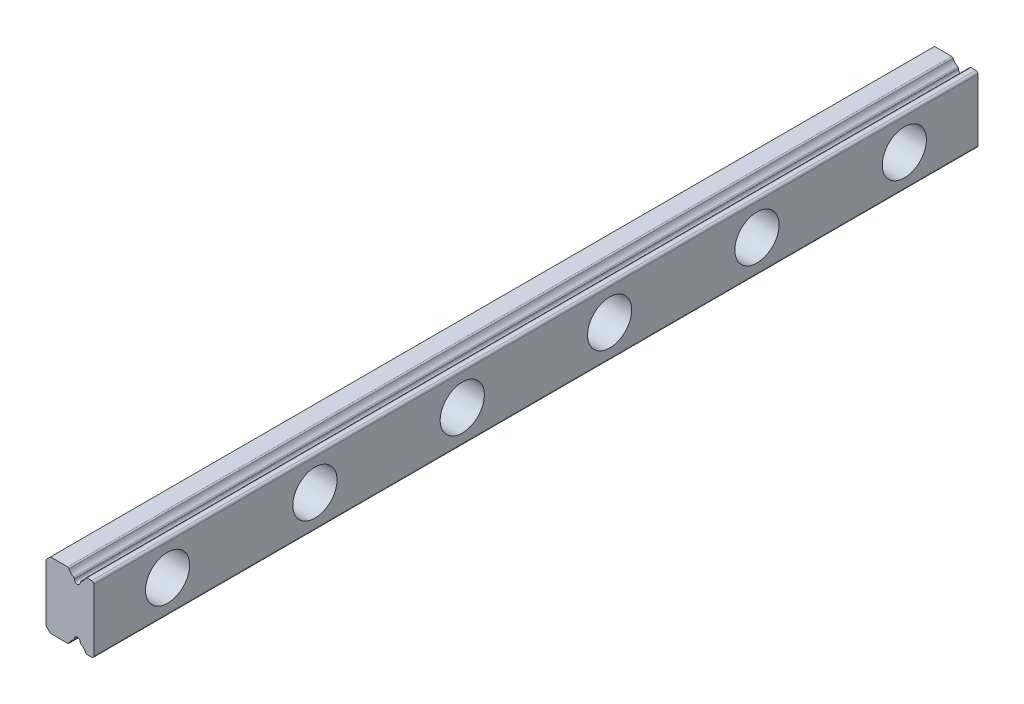
from build123d import *

# Parameters (mm, degrees)
EXTRUDE_1_DEPTH     = 120
SKETCH_2_R          = 3
CUT_EXTRUDE_1_DEPTH = 4.5
SKETCH_3_R          = 1.75
CUT_EXTRUDE_2_DEPTH = 121.421136019


with BuildPart() as part:
    # 草图1 → 凸台-拉伸1 (new body)
    with BuildSketch(Plane.XY):
        with BuildLine():
            ThreePointArc((6.2, 9), (6.412132034, 8.912132034), (6.5, 8.7))
            Line((6.5, 8.7), (6.5, 0.3))
            ThreePointArc((6.5, 0.3), (6.412132034, 0.087867966), (6.2, 0))
            Line((6.2, 0), (5.557669683, 0))
            ThreePointArc((5.557669683, 0), (5.444280341, 0.035249106), (5.370859728, 0.128571429))
            ThreePointArc((5.370859728, 0.128571429), (5.130846451, 0.514929157), (4.764285714, 0.784209483))
            ThreePointArc((4.764285714, 0.784209483), (4.680969149, 0.858006567), (4.65, 0.964911064))
            Line((4.65, 0.964911064), (4.65, 1))
            ThreePointArc((4.65, 1), (4.25, 1.4), (3.85, 1))
            Line((3.85, 1), (3.85, 0.964911064))
            ThreePointArc((3.85, 0.964911064), (3.819030851, 0.858006567), (3.735714286, 0.784209483))
            ThreePointArc((3.735714286, 0.784209483), (3.369153549, 0.514929157), (3.129140272, 0.128571429))
            ThreePointArc((3.129140272, 0.128571429), (3.055719659, 0.035249106), (2.942330317, 0))
            Line((2.942330317, 0), (0.6, 0))
            Line((0.6, 0), (0, 0.6))
            Line((0, 0.6), (0, 8.4))
            Line((0, 8.4), (0.6, 9))
            Line((0.6, 9), (2.942330317, 9))
            ThreePointArc((2.942330317, 9), (3.055719659, 8.964750894), (3.129140272, 8.871428571))
            ThreePointArc((3.129140272, 8.871428571), (3.369153549, 8.485070843), (3.735714286, 8.215790517))
            ThreePointArc((3.735714286, 8.215790517), (3.819030851, 8.141993433), (3.85, 8.035088936))
            Line((3.85, 8.035088936), (3.85, 8))
            ThreePointArc((3.85, 8), (4.25, 7.6), (4.65, 8))
            Line((4.65, 8), (4.65, 8.035088936))
            ThreePointArc((4.65, 8.035088936), (4.680969149, 8.141993433), (4.764285714, 8.215790517))
            ThreePointArc((4.764285714, 8.215790517), (5.130846451, 8.485070843), (5.370859728, 8.871428571))
            ThreePointArc((5.370859728, 8.871428571), (5.444280341, 8.964750894), (5.557669683, 9))
            Line((5.557669683, 9), (6.2, 9))
        make_face()
    extrude(amount=EXTRUDE_1_DEPTH)

    # 草图2 → 切除-拉伸1 (cut)
    with BuildSketch(Plane(origin=(6.5, 0, 0), x_dir=(0, 0, -1), z_dir=(1, 0, 0))):
        with Locations((-10, 4.5)):
            Circle(SKETCH_2_R)
        with Locations((-30, 4.5)):
            Circle(SKETCH_2_R)
        with Locations((-50, 4.5)):
            Circle(SKETCH_2_R)
        with Locations((-70, 4.5)):
            Circle(SKETCH_2_R)
        with Locations((-90, 4.5)):
            Circle(SKETCH_2_R)
        with Locations((-110, 4.5)):
            Circle(SKETCH_2_R)
        with Locations((-130, 4.5)):
            Circle(SKETCH_2_R)
        with Locations((-150, 4.5)):
            Circle(SKETCH_2_R)
        with Locations((-170, 4.5)):
            Circle(SKETCH_2_R)
        with Locations((-190, 4.5)):
            Circle(SKETCH_2_R)
        with Locations((-210, 4.5)):
            Circle(SKETCH_2_R)
        with Locations((-230, 4.5)):
            Circle(SKETCH_2_R)
        with Locations((-250, 4.5)):
            Circle(SKETCH_2_R)
        with Locations((-270, 4.5)):
            Circle(SKETCH_2_R)
        with Locations((-290, 4.5)):
            Circle(SKETCH_2_R)
        with Locations((-310, 4.5)):
            Circle(SKETCH_2_R)
        with Locations((-330, 4.5)):
            Circle(SKETCH_2_R)
        with Locations((-350, 4.5)):
            Circle(SKETCH_2_R)
        with Locations((-370, 4.5)):
            Circle(SKETCH_2_R)
        with Locations((-390, 4.5)):
            Circle(SKETCH_2_R)
        with Locations((-410, 4.5)):
            Circle(SKETCH_2_R)
        with Locations((-430, 4.5)):
            Circle(SKETCH_2_R)
        with Locations((-450, 4.5)):
            Circle(SKETCH_2_R)
        with Locations((-470, 4.5)):
            Circle(SKETCH_2_R)
        with Locations((-490, 4.5)):
            Circle(SKETCH_2_R)
    extrude(amount=-CUT_EXTRUDE_1_DEPTH, mode=Mode.SUBTRACT)

    # 草图3 → 切除-拉伸2 (cut, through all)
    with BuildSketch(Plane(origin=(2, 0, 0), x_dir=(0, 0, -1), z_dir=(1, 0, 0))):
        with Locations((-10, 4.5)):
            Circle(SKETCH_3_R)
        with Locations((-30, 4.5)):
            Circle(SKETCH_3_R)
        with Locations((-50, 4.5)):
            Circle(SKETCH_3_R)
        with Locations((-70, 4.5)):
            Circle(SKETCH_3_R)
        with Locations((-90, 4.5)):
            Circle(SKETCH_3_R)
        with Locations((-110, 4.5)):
            Circle(SKETCH_3_R)
        with Locations((-130, 4.5)):
            Circle(SKETCH_3_R)
        with Locations((-150, 4.5)):
            Circle(SKETCH_3_R)
        with Locations((-170, 4.5)):
            Circle(SKETCH_3_R)
        with Locations((-190, 4.5)):
            Circle(SKETCH_3_R)
        with Locations((-210, 4.5)):
            Circle(SKETCH_3_R)
        with Locations((-230, 4.5)):
            Circle(SKETCH_3_R)
        with Locations((-250, 4.5)):
            Circle(SKETCH_3_R)
        with Locations((-270, 4.5)):
            Circle(SKETCH_3_R)
        with Locations((-290, 4.5)):
            Circle(SKETCH_3_R)
        with Locations((-310, 4.5)):
            Circle(SKETCH_3_R)
        with Locations((-330, 4.5)):
            Circle(SKETCH_3_R)
        with Locations((-350, 4.5)):
            Circle(SKETCH_3_R)
        with Locations((-370, 4.5)):
            Circle(SKETCH_3_R)
        with Locations((-390, 4.5)):
            Circle(SKETCH_3_R)
        with Locations((-410, 4.5)):
            Circle(SKETCH_3_R)
        with Locations((-430, 4.5)):
            Circle(SKETCH_3_R)
        with Locations((-450, 4.5)):
            Circle(SKETCH_3_R)
        with Locations((-470, 4.5)):
            Circle(SKETCH_3_R)
        with Locations((-490, 4.5)):
            Circle(SKETCH_3_R)
    extrude(amount=-CUT_EXTRUDE_2_DEPTH, mode=Mode.SUBTRACT)


solid = part.part
